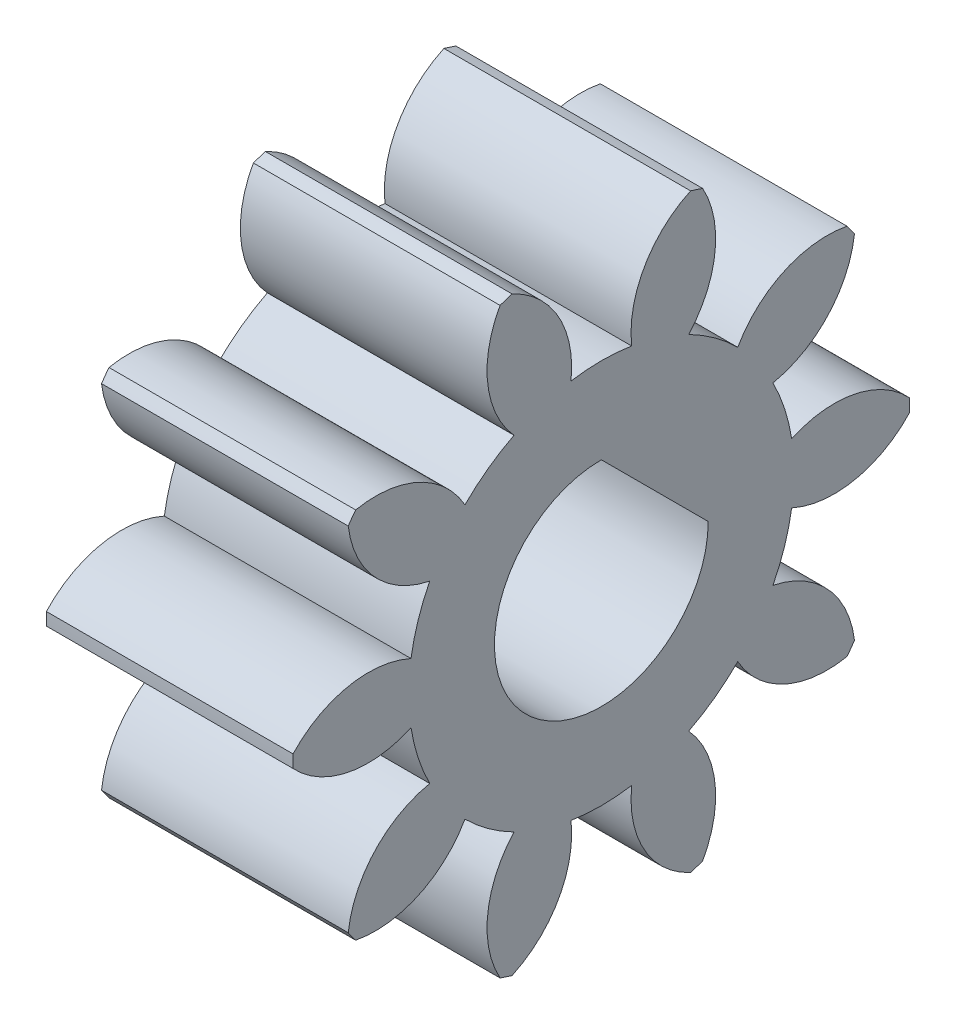
from build123d import *

# Parameters (mm, degrees)
BASPROSKE_W         = 6
BASPROSKE_H         = 7.5
TOOTHCUT_DEPTH      = 13.186057607
TEETHCUTS_COUNT     = 10
TEETHCUTS_ANGLE     = 324
BORSKE_R            = 2.5
BORE_DEPTH          = 50.0000508
SKETCH1_R           = 2.6
CUT_EXTRUDE1_DEPTH  = 12.991156361
BOSS_EXTRUDE1_DEPTH = 6


with BuildPart() as part:
    # BasProSke → Base-Revolve (revolve)
    with BuildSketch(Plane(origin=(0, 0, 0), x_dir=(1, 0, 0), z_dir=(0, 1, 0)), mode=Mode.PRIVATE) as base_revolve_sk:
        with Locations((3, 3.75)):
            Rectangle(BASPROSKE_W, BASPROSKE_H)
    revolve(base_revolve_sk.sketch.rotate(Axis((-10, 0, 0), (1, 0, 0)), 180), axis=Axis((-10, 0, 0), (1, 0, 0)))

    # TooCutSke → ToothCut (cut, through all)
    with BuildSketch(Plane(origin=(0, 0, 0), x_dir=(0, 0, -1), z_dir=(1, 0, 0))):
        with BuildLine():
            ThreePointArc((0.737676151, 4.628079099), (0, 4.6865), (-0.737676151, 4.628079099))
            ThreePointArc((-0.737676151, 4.628079099), (-1.051542781, 6.151798382), (-2.205760267, 7.194877817))
            ThreePointArc((-2.205760267, 7.194877817), (0, 7.5254), (2.205760267, 7.194877817))
            ThreePointArc((2.205760267, 7.194877817), (1.051542781, 6.151798382), (0.737676151, 4.628079099))
        make_face()
    toothcut = extrude(amount=TOOTHCUT_DEPTH, mode=Mode.SUBTRACT)

    # TeethCuts: ToothCut ×10 about axis
    teethcuts_axis = Axis((-10, 0, 0), (1, 0, 0))
    for i in range(1, TEETHCUTS_COUNT):
        add(toothcut.rotate(teethcuts_axis, i * TEETHCUTS_ANGLE / (TEETHCUTS_COUNT - 1)), mode=Mode.SUBTRACT)

    # BorSke → Bore (cut, symmetric)
    with BuildSketch(Plane(origin=(0, 0, 0), x_dir=(0, 0, -1), z_dir=(1, 0, 0))):
        with Locations(Location((0, 0, 0), (0, 0, 180))):
            Circle(BORSKE_R)
    extrude(amount=BORE_DEPTH, both=True, mode=Mode.SUBTRACT)

    # Sketch1 → Cut-Extrude1 (cut, through all)
    with BuildSketch(Plane(origin=(6, 0, 0), x_dir=(0, 0, -1), z_dir=(1, 0, 0))):
        Circle(SKETCH1_R)
    extrude(amount=-CUT_EXTRUDE1_DEPTH, mode=Mode.SUBTRACT)

    # Sketch2 → Boss-Extrude1 (add)
    with BuildSketch(Plane(origin=(6, 0, 0), x_dir=(0, 0, -1), z_dir=(1, 0, 0))):
        Polygon((0, 2.6), (2.6, 0), (2.6, 2.6), align=None)
    extrude(amount=-BOSS_EXTRUDE1_DEPTH)


solid = part.part
